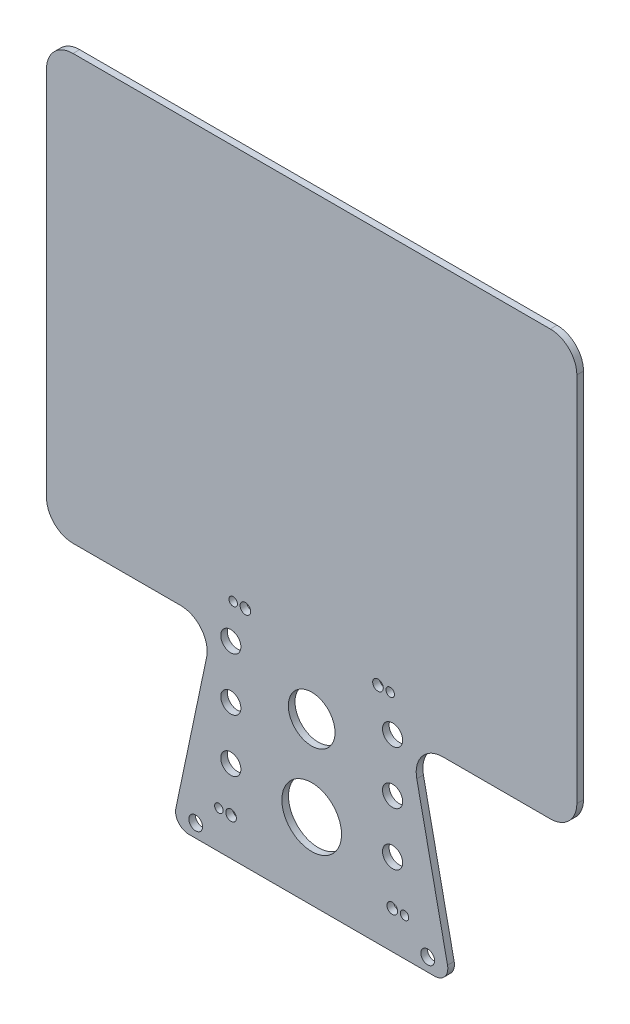
from build123d import *

# Parameters (mm, degrees)
BOSS_EXTRUDE1_DEPTH = 3.175
FILLET1_R           = 6.35
SKETCH2_R           = 3.302
CUT_EXTRUDE1_DEPTH  = 161.944735796
SKETCH3_R           = 2.54
SKETCH3_R_2         = 2.032
CUT_EXTRUDE2_DEPTH  = 161.944735796
SKETCH4_R           = 14.2875
SKETCH4_R_2         = 11.176
SKETCH4_R_3         = 2.54
SKETCH4_R_4         = 2.032
CUT_EXTRUDE3_DEPTH  = 161.944735796
SKETCH5_R           = 4.826
CUT_EXTRUDE4_DEPTH  = 161.944735796
BOSS_EXTRUDE2_DEPTH = 3.175
FILLET2_R           = 12.7
FILLET3_R           = 12.7


with BuildPart() as part:
    # Sketch1 → Boss-Extrude1 (new body)
    with BuildSketch(Plane.XY):
        Polygon((0, 0), (-82.55, 0), (-107.95, -120.65), (25.4, -120.65), align=None)
    extrude(amount=BOSS_EXTRUDE1_DEPTH)

    # Fillet1
    fillet1_edges = [part.edges().sort_by_distance(p)[0] for p in [
        (25.4, -120.65, 1.5875),
        (-107.95, -120.65, 1.5875),
        (-82.55, 0, 1.5875),
        (0, 0, 1.5875),
    ]]
    fillet(fillet1_edges, radius=FILLET1_R)

    # Sketch2 → Cut-Extrude1 (cut, through all)
    with BuildSketch(Plane(origin=(0, 0, 0), x_dir=(-1, 0, 0), z_dir=(0, 0, -1))):
        with Locations((-14.2875, -114.3)):
            Circle(SKETCH2_R)
        with Locations((96.8375, -114.3)):
            Circle(SKETCH2_R)
    extrude(amount=-CUT_EXTRUDE1_DEPTH, mode=Mode.SUBTRACT)

    # Sketch3 → Cut-Extrude2 (cut, through all)
    with BuildSketch(Plane(origin=(0, 0, 0), x_dir=(-1, 0, 0), z_dir=(0, 0, -1))):
        with Locations((9.525, -13.462)):
            Circle(SKETCH3_R)
        with Locations((73.025, -13.462)):
            Circle(SKETCH3_R)
        with Locations((3.683, -13.462)):
            Circle(SKETCH3_R_2)
        with Locations((78.867, -13.462)):
            Circle(SKETCH3_R_2)
    extrude(amount=-CUT_EXTRUDE2_DEPTH, mode=Mode.SUBTRACT)

    # Sketch4 → Cut-Extrude3 (cut, through all)
    with BuildSketch(Plane.XY.offset(3.175)):
        with Locations((-41.275, -84.074)):
            Circle(SKETCH4_R)
        with Locations((-41.275, -43.434)):
            Circle(SKETCH4_R_2)
        with Locations((-2.667, -102.616)):
            Circle(SKETCH4_R_3)
        with Locations((-79.883, -102.616)):
            Circle(SKETCH4_R_3)
        with Locations((-85.725, -102.616)):
            Circle(SKETCH4_R_4)
        with Locations((3.175, -102.616)):
            Circle(SKETCH4_R_4)
    extrude(amount=-CUT_EXTRUDE3_DEPTH, mode=Mode.SUBTRACT)

    # Sketch5 → Cut-Extrude4 (cut, through all)
    with BuildSketch(Plane.XY.offset(3.175)):
        with Locations((-80.01, -30.48)):
            Circle(SKETCH5_R)
        with Locations((-80.01, -55.88)):
            Circle(SKETCH5_R)
        with Locations((-80.01, -81.28)):
            Circle(SKETCH5_R)
        with Locations((-2.54, -81.28)):
            Circle(SKETCH5_R)
        with Locations((-2.54, -55.88)):
            Circle(SKETCH5_R)
        with Locations((-2.54, -30.48)):
            Circle(SKETCH5_R)
    extrude(amount=-CUT_EXTRUDE4_DEPTH, mode=Mode.SUBTRACT)

    # Sketch6 → Boss-Extrude2 (add)
    with BuildSketch(Plane.XY.offset(3.175)):
        with BuildLine():
            Line((-88.378631579, -27.686), (-168.275, -27.686))
            Line((-168.275, -27.686), (-168.275, 175.514))
            Line((-168.275, 175.514), (85.725, 175.514))
            Line((85.725, 175.514), (85.725, -27.686))
            Line((85.725, -27.686), (5.828631579, -27.686))
            Line((5.828631579, -27.686), (1.06143862, -5.041833445))
            ThreePointArc((1.06143862, -5.041833445), (-1.151374985, -1.419008334), (-5.152352515, 0))
            Line((-5.152352515, 0), (-77.397647485, 0))
            ThreePointArc((-77.397647485, 0), (-81.398625015, -1.419008334), (-83.61143862, -5.041833445))
            Line((-83.61143862, -5.041833445), (-88.378631579, -27.686))
        make_face()
    extrude(amount=-BOSS_EXTRUDE2_DEPTH)

    # Fillet2
    fillet2_edges = [part.edges().sort_by_distance(p)[0] for p in [
        (-88.378631579, -27.686, 1.5875),
        (5.828631579, -27.686, 1.5875),
    ]]
    fillet(fillet2_edges, radius=FILLET2_R)

    # Fillet3
    fillet3_edges = [part.edges().sort_by_distance(p)[0] for p in [
        (-168.275, -27.686, 1.5875),
        (-168.275, 175.514, 1.5875),
        (85.725, 175.514, 1.5875),
        (85.725, -27.686, 1.5875),
    ]]
    fillet(fillet3_edges, radius=FILLET3_R)


solid = part.part
